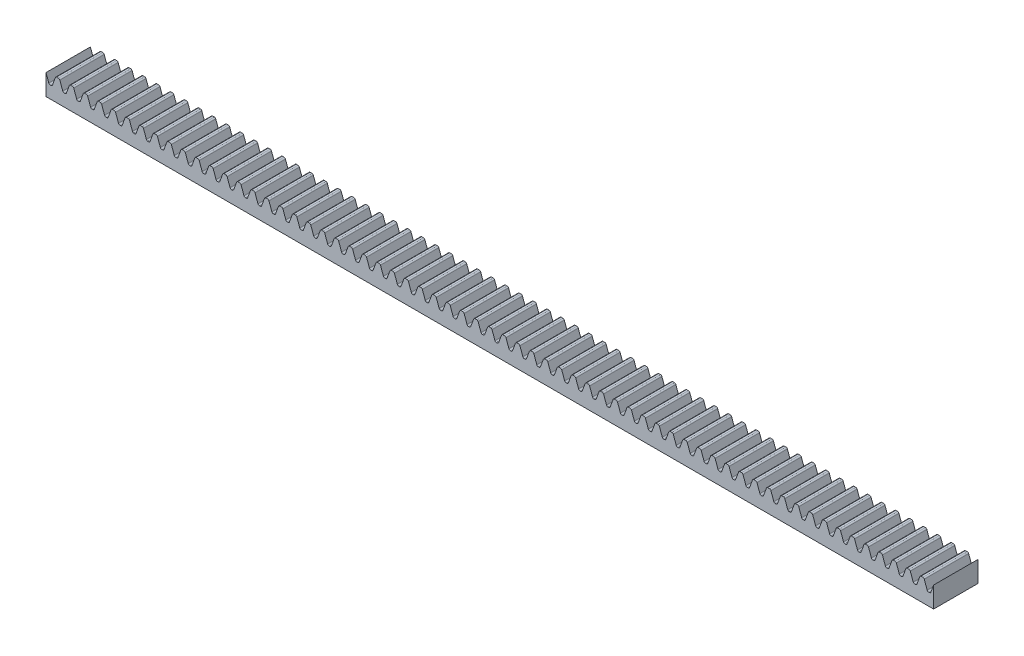
from build123d import *

# Parameters (mm, degrees)
BOSS_EXTRUDE1_DEPTH      = 2.5
BOSS_EXTRUDE1_DEPTH_BACK = 2.5
SKETCH3_W                = 100
SKETCH3_H                = 12
CUT_EXTRUDE1_DEPTH       = 51.420729864
LPATTERN1_COUNT          = 64
LPATTERN1_PITCH          = 1.570796327
LPATTERN1_COL_COUNT      = 2
LPATTERN1_COL_PITCH      = 1.570796327
SKETCH5_W                = 100
SKETCH5_H                = 9.5
CUT_EXTRUDE2_DEPTH       = 51.606323716


with BuildPart() as part:
    # Sketch3 → Boss-Extrude1 (new, two sides: drawn at the far end of the back side and taken through both)
    with BuildSketch(Plane.XY.offset(-BOSS_EXTRUDE1_DEPTH_BACK)):
        Rectangle(SKETCH3_W, SKETCH3_H)
    extrude(amount=BOSS_EXTRUDE1_DEPTH + BOSS_EXTRUDE1_DEPTH_BACK)

    # Sketch4 → Cut-Extrude1 (cut, symmetric)
    with BuildSketch(Plane.XY):
        with BuildLine():
            Line((-48.945574321, 5.889622222), (-48.905400095, 6))
            Line((-48.905400095, 6), (-49.480084294, 6))
            Line((-49.480084294, 6), (-49.480084294, 4.875))
            Line((-49.480084294, 4.875), (-49.432328186, 4.875))
            ThreePointArc((-49.432328186, 4.875), (-49.336109295, 4.9053377), (-49.274692383, 4.985377778))
            Line((-49.274692383, 4.985377778), (-48.945574321, 5.889622222))
        make_face()
        with BuildLine():
            Line((-48.787938518, 6), (-48.905400095, 6))
            Line((-48.905400095, 6), (-48.945574321, 5.889622222))
            ThreePointArc((-48.945574321, 5.889622222), (-48.884157409, 5.9696623), (-48.787938518, 6))
        make_face()
        with BuildLine():
            Line((-48.44379794, 5.889622222), (-48.483972166, 6))
            Line((-48.483972166, 6), (-48.601433744, 6))
            ThreePointArc((-48.601433744, 6), (-48.505214852, 5.9696623), (-48.44379794, 5.889622222))
        make_face()
        with BuildLine():
            Line((-47.909287967, 4.875), (-47.909287967, 6))
            Line((-47.909287967, 6), (-48.483972166, 6))
            Line((-48.483972166, 6), (-48.44379794, 5.889622222))
            Line((-48.44379794, 5.889622222), (-48.114679878, 4.985377778))
            ThreePointArc((-48.114679878, 4.985377778), (-48.053262966, 4.9053377), (-47.957044075, 4.875))
            Line((-47.957044075, 4.875), (-47.909287967, 4.875))
        make_face()
    cut_extrude1 = extrude(amount=CUT_EXTRUDE1_DEPTH, both=True, mode=Mode.SUBTRACT)

    # LPattern1: Cut-Extrude1 ×64
    with Locations(*[(i * LPATTERN1_PITCH, 0, 0) for i in range(1, LPATTERN1_COUNT)]):
        add(cut_extrude1, mode=Mode.SUBTRACT)

    # LPattern1 col: Cut-Extrude1 ×2
    with Locations(*[(-i * LPATTERN1_COL_PITCH, 0, 0) for i in range(1, LPATTERN1_COL_COUNT)]):
        add(cut_extrude1, mode=Mode.SUBTRACT)

    # Sketch5 → Cut-Extrude2 (cut, through all)
    with BuildSketch(Plane.XY.offset(2.5)):
        with Locations((0, -1.25)):
            Rectangle(SKETCH5_W, SKETCH5_H)
    extrude(amount=-CUT_EXTRUDE2_DEPTH, mode=Mode.SUBTRACT)


solid = part.part
